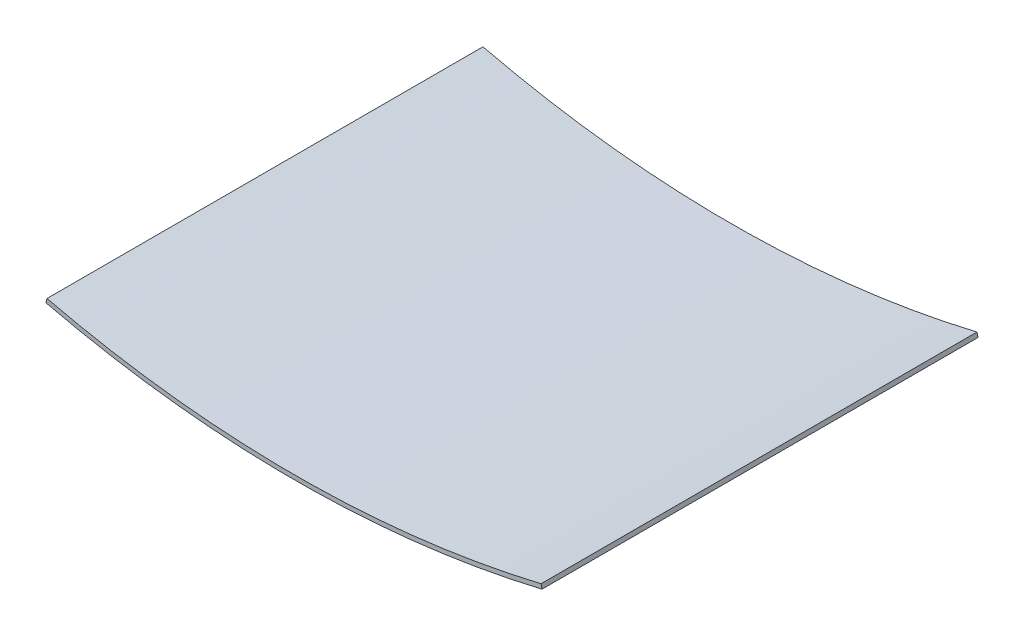
from build123d import *

# Parameters (mm, degrees)
EXTRUIR_L_MINA1_DEPTH = 381


with BuildPart() as part:
    # Croquis1 → Extruir-Lámina1 (new body)
    with BuildSketch(Plane.XY):
        with BuildLine():
            ThreePointArc((-215.9, 25.4), (0, 0), (215.9, 25.4))
            Line((215.9, 25.4), (216.784232082, 21.694027304))
            ThreePointArc((216.784232082, 21.694027304), (0, -3.81), (-216.784232082, 21.694027304))
            Line((-216.784232082, 21.694027304), (-215.9, 25.4))
        make_face()
    extrude(amount=EXTRUIR_L_MINA1_DEPTH)


solid = part.part
